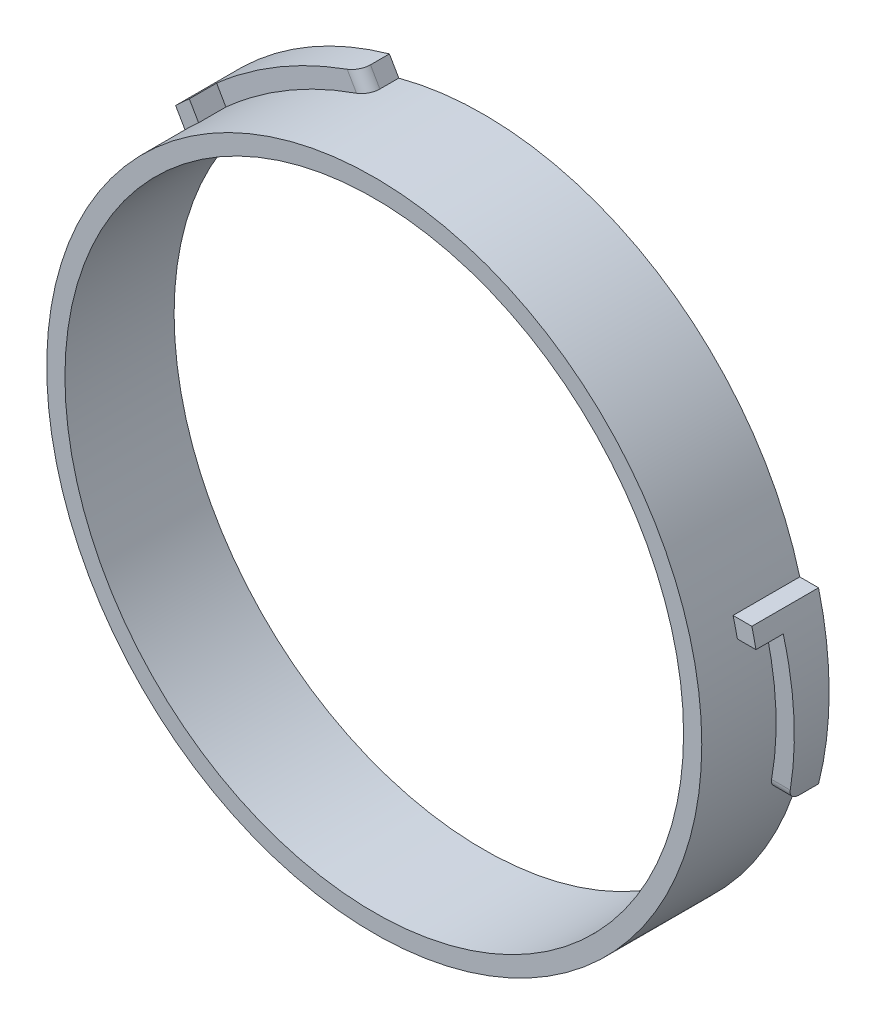
from build123d import *

# Parameters (mm, degrees)
EXTRUDE_1_DEPTH                  = 10
FILLET_1_R                       = 2
PATTERN_CIRCULAR_2_COUNT         = 3
FILLET_1_OF_PATTERN_CIRCULAR_2_R = 2
CUT_EXTRUDE_START                = -15
SKETCH_3_R                       = 51
CUT_EXTRUDE_1_DEPTH              = 15
SKETCH_4_R                       = 62.618720145
SKETCH_4_R_2                     = 57
CUT_EXTRUDE_2_DEPTH              = 15
CHAMFER_1_SIZE                   = 2
FILLET_2_R                       = 5
SKETCH_5_R                       = 42.5
EXTRUDE_2_DEPTH                  = 3
SKETCH_7_R                       = 39.5
CUT_EXTRUDE_3_DEPTH              = 3
EXTRUDE_START                    = 3
SKETCH_8_W                       = 3
SKETCH_8_H                       = 3
EXTRUDE_4_DEPTH                  = 3
SKETCH_11_R                      = 73.482680971
CUT_EXTRUDE_4_DEPTH              = 130


with BuildPart() as part:
    # Эскиз1 → Повернуть1 (revolve)
    with BuildSketch(Plane(origin=(0, 0, 0), x_dir=(1, 0, 0), z_dir=(0, 1, 0))):
        Polygon((0, 0), (-54, 0), (-54, 145), (-51, 145), (-51, 3), (0, 3), align=None)
    revolve(axis=Axis((0, 0, -3), (0, 0, 1)))

    # Эскиз2 → Бобышка-Вытянуть1 (add)
    with BuildSketch(Plane(origin=(57, 0, 0), x_dir=(0, 0, -1), z_dir=(1, 0, 0))):
        Polygon((145, 14), (145, -14), (140, -14), (138.5, 11), (134, 11), (134, 14), align=None)
    extrude_1 = extrude(amount=-EXTRUDE_1_DEPTH)

    # Скругление1
    fillet_1_edges = [part.edges().sort_by_distance(p)[0] for p in [
        (54.576809621, -14, -140),
    ]]
    fillet(fillet_1_edges, radius=FILLET_1_R)

    # Круговой массив2: Бобышка-Вытянуть1 ×3 about axis
    pattern_circular_2_axis = Axis((0, 0, 0), (0, 0, 1))
    for i in range(1, PATTERN_CIRCULAR_2_COUNT):
        add(extrude_1.rotate(pattern_circular_2_axis, i * 360 / PATTERN_CIRCULAR_2_COUNT))

    # Скругление1 of Круговой массив2
    fillet_1_of_pattern_circular_2_edges = [part.edges().sort_by_distance(p)[0] for p in [
        (-15.164049157, 54.264903589, -140),
        (-39.412760463, -40.264903589, -140),
    ]]
    fillet(fillet_1_of_pattern_circular_2_edges, radius=FILLET_1_OF_PATTERN_CIRCULAR_2_R)

    # Эскиз3 → Вырез-Вытянуть1 (cut)
    with BuildSketch(Plane(origin=(0, 0, -145), x_dir=(-1, 0, 0), z_dir=(0, 0, -1)).offset(CUT_EXTRUDE_START)):
        Circle(SKETCH_3_R)
    extrude(amount=CUT_EXTRUDE_1_DEPTH, mode=Mode.SUBTRACT)

    # Эскиз4 → Вырез-Вытянуть2 (cut)
    with BuildSketch(Plane(origin=(0, 0, -145), x_dir=(-1, 0, 0), z_dir=(0, 0, -1))):
        Circle(SKETCH_4_R)
        Circle(SKETCH_4_R_2, mode=Mode.SUBTRACT)
    extrude(amount=-CUT_EXTRUDE_2_DEPTH, mode=Mode.SUBTRACT)

    # Фаска1
    chamfer_1_edges = [part.edges().sort_by_distance(p)[0] for p in [
        (54, 0, 0),
    ]]
    chamfer(chamfer_1_edges, length=CHAMFER_1_SIZE)

    # Скругление2
    fillet_2_edges = [part.edges().sort_by_distance(p)[0] for p in [
        (51, 0, -3),
    ]]
    fillet(fillet_2_edges, radius=FILLET_2_R)

    # Эскиз5 → Бобышка-Вытянуть2 (add)
    with BuildSketch(Plane.XY):
        Circle(SKETCH_5_R)
    extrude(amount=EXTRUDE_2_DEPTH)

    # Эскиз7 → Вырез-Вытянуть3 (cut)
    with BuildSketch(Plane.XY.offset(3)):
        Circle(SKETCH_7_R)
    extrude(amount=-CUT_EXTRUDE_3_DEPTH, mode=Mode.SUBTRACT)

    # Эскиз8 → Бобышка-Вытянуть4 (add)
    with BuildSketch(Plane.XY.offset(EXTRUDE_START)):
        with BuildLine():
            Line((-1.5, -7.858116823), (-1.5, -39.471508712))
            ThreePointArc((-1.5, -39.471508712), (0, -39.5), (1.5, -39.471508712))
            Line((1.5, -39.471508712), (1.5, -7.858116823))
            ThreePointArc((1.5, -7.858116823), (0, -8), (-1.5, -7.858116823))
        make_face()
        with BuildLine():
            ThreePointArc((1.5, 39.471508712), (0, 39.5), (-1.5, 39.471508712))
            Line((-1.5, 39.471508712), (-1.5, 7.858116823))
            ThreePointArc((-1.5, 7.858116823), (0, 8), (1.5, 7.858116823))
            Line((1.5, 7.858116823), (1.5, 39.471508712))
        make_face()
        with BuildLine():
            Line((-1.5, 7.858116823), (-1.5, 1.5))
            Line((-1.5, 1.5), (1.5, 1.5))
            Line((1.5, 1.5), (1.5, 7.858116823))
            ThreePointArc((1.5, 7.858116823), (0, 8), (-1.5, 7.858116823))
        make_face()
        with BuildLine():
            Line((1.5, 7.858116823), (1.5, 1.5))
            Line((1.5, 1.5), (7.858116823, 1.5))
            ThreePointArc((7.858116823, 1.5), (5.656854249, 5.656854249), (1.5, 7.858116823))
        make_face()
        with BuildLine():
            Line((1.5, 1.5), (1.5, -1.5))
            Line((1.5, -1.5), (7.858116823, -1.5))
            ThreePointArc((7.858116823, -1.5), (7.964450219, -0.753347668), (8, 0))
            ThreePointArc((8, 0), (7.964450219, 0.753347668), (7.858116823, 1.5))
            Line((7.858116823, 1.5), (1.5, 1.5))
        make_face()
        with BuildLine():
            ThreePointArc((-39.471508712, 1.5), (-39.5, 0), (-39.471508712, -1.5))
            Line((-39.471508712, -1.5), (-7.858116823, -1.5))
            ThreePointArc((-7.858116823, -1.5), (-8, 0), (-7.858116823, 1.5))
            Line((-7.858116823, 1.5), (-39.471508712, 1.5))
        make_face()
        with BuildLine():
            Line((7.858116823, -1.5), (39.471508712, -1.5))
            ThreePointArc((39.471508712, -1.5), (39.492876536, -0.75013528), (39.5, 0))
            ThreePointArc((39.5, 0), (39.492876536, 0.75013528), (39.471508712, 1.5))
            Line((39.471508712, 1.5), (7.858116823, 1.5))
            ThreePointArc((7.858116823, 1.5), (7.964450219, 0.753347668), (8, 0))
            ThreePointArc((8, 0), (7.964450219, -0.753347668), (7.858116823, -1.5))
        make_face()
        with BuildLine():
            Line((1.5, -1.5), (1.5, -7.858116823))
            ThreePointArc((1.5, -7.858116823), (5.656854249, -5.656854249), (7.858116823, -1.5))
            Line((7.858116823, -1.5), (1.5, -1.5))
        make_face()
        with BuildLine():
            Line((-1.5, -1.5), (-1.5, -7.858116823))
            ThreePointArc((-1.5, -7.858116823), (0, -8), (1.5, -7.858116823))
            Line((1.5, -7.858116823), (1.5, -1.5))
            Line((1.5, -1.5), (-1.5, -1.5))
        make_face()
        Rectangle(SKETCH_8_W, SKETCH_8_H)
        with BuildLine():
            Line((-7.858116823, 1.5), (-1.5, 1.5))
            Line((-1.5, 1.5), (-1.5, 7.858116823))
            ThreePointArc((-1.5, 7.858116823), (-5.656854249, 5.656854249), (-7.858116823, 1.5))
        make_face()
        with BuildLine():
            Line((-7.858116823, -1.5), (-1.5, -1.5))
            Line((-1.5, -1.5), (-1.5, 1.5))
            Line((-1.5, 1.5), (-7.858116823, 1.5))
            ThreePointArc((-7.858116823, 1.5), (-8, 0), (-7.858116823, -1.5))
        make_face()
        with BuildLine():
            ThreePointArc((-7.858116823, -1.5), (-5.656854249, -5.656854249), (-1.5, -7.858116823))
            Line((-1.5, -7.858116823), (-1.5, -1.5))
            Line((-1.5, -1.5), (-7.858116823, -1.5))
        make_face()
    extrude(amount=-EXTRUDE_4_DEPTH)

    # Эскиз11 → Вырез-Вытянуть4 (cut)
    with BuildSketch(Plane.XY.offset(3)):
        Circle(SKETCH_11_R)
    extrude(amount=-CUT_EXTRUDE_4_DEPTH, mode=Mode.SUBTRACT)


solid = part.part
